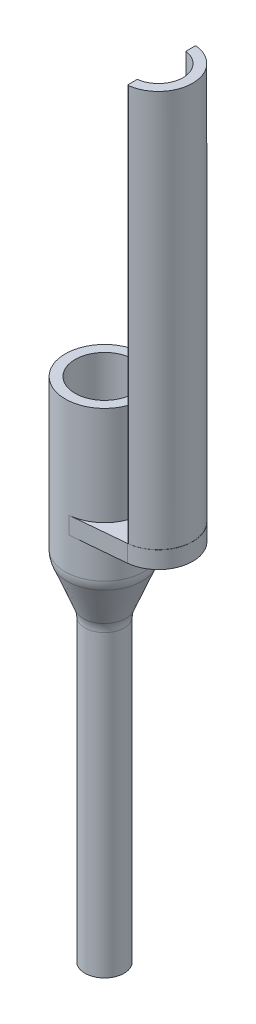
from build123d import *

# Parameters (mm, degrees)
FILLET_1_R      = 5
EXTRUDE_1_DEPTH = 4
CHAMFER_1_SIZE  = 3
CHAMFER_1_SIZE2 = 0.5
EXTRUDE_2_DEPTH = 81
FILLET_2_R      = 0.2


with BuildPart() as part:
    # Эскиз1 → Повернуть1 (revolve)
    with BuildSketch(Plane.XY):
        Polygon((8, 23.5), (8, -8), (4, -18), (4, -80), (3.1, -80), (3.1, -8), (6, -8), (6, 23.5), align=None)
    revolve(axis=Axis((0, -1000, 0), (0, 1, 0)))

    # Скругление1
    fillet_1_edges = [part.edges().sort_by_distance(p)[0] for p in [
        (-8, -8, 0),
        (-4, -18, 0),
    ]]
    fillet(fillet_1_edges, radius=FILLET_1_R)


with BuildPart() as body_2:
    # Эскиз2 → Бобышка-Вытянуть1 (new body)
    with BuildSketch(Plane(origin=(0, 3.3, 0), x_dir=(1, 0, 0), z_dir=(0, 1, 0))):
        with BuildLine():
            Line((11.639394602, 6.971030521), (0.727071693, 7.966905416))
            ThreePointArc((0.727071693, 7.966905416), (8.000013447, -4.909e-06), (0.727061916, -7.966906308))
            Line((0.727061916, -7.966906308), (11.639394602, -6.971030521))
            ThreePointArc((11.639394602, -6.971030521), (18.00320794, 0), (11.639394602, 6.971030521))
        make_face()
    extrude(amount=-EXTRUDE_1_DEPTH)

    # Фаска1
    chamfer_1_edges = [body_2.edges().sort_by_distance(p)[0] for p in [
        (18.00320794, -0.7, 0),
        (6.183233147, -0.7, -7.468967969),
        (6.183228259, -0.7, 7.468968415),
    ]]
    chamfer_1_side = [body_2.faces().sort_by_distance(p)[0] for p in [
        (11.436559393, -0.7, 0),
    ]]
    chamfer(chamfer_1_edges, length=CHAMFER_1_SIZE, length2=CHAMFER_1_SIZE2, reference=chamfer_1_side[0])

    # Эскиз3 → Бобышка-Вытянуть2 (add)
    with BuildSketch(Plane(origin=(0, 3.3, 0), x_dir=(1, 0, 0), z_dir=(0, 1, 0))):
        with BuildLine():
            Line((11.64037122, 4.959236126), (11.639394602, 6.971030521))
            ThreePointArc((11.639394602, 6.971030521), (17.978333284, 0), (11.639394602, -6.971030521))
            Line((11.639394602, -6.971030521), (11.640066766, -4.959275233))
            ThreePointArc((11.640066766, -4.959275233), (16.003207938, -0.000153478), (11.64037122, 4.959236126))
        make_face()
    extrude(amount=EXTRUDE_2_DEPTH)

    # Скругление2
    fillet_2_edges = [body_2.edges().sort_by_distance(p)[0] for p in [
        (11.639394602, 43.8, 6.971030521),
        (11.639394602, 43.8, -6.971030521),
    ]]
    fillet(fillet_2_edges, radius=FILLET_2_R)


solid = Compound([part.part, body_2.part])
